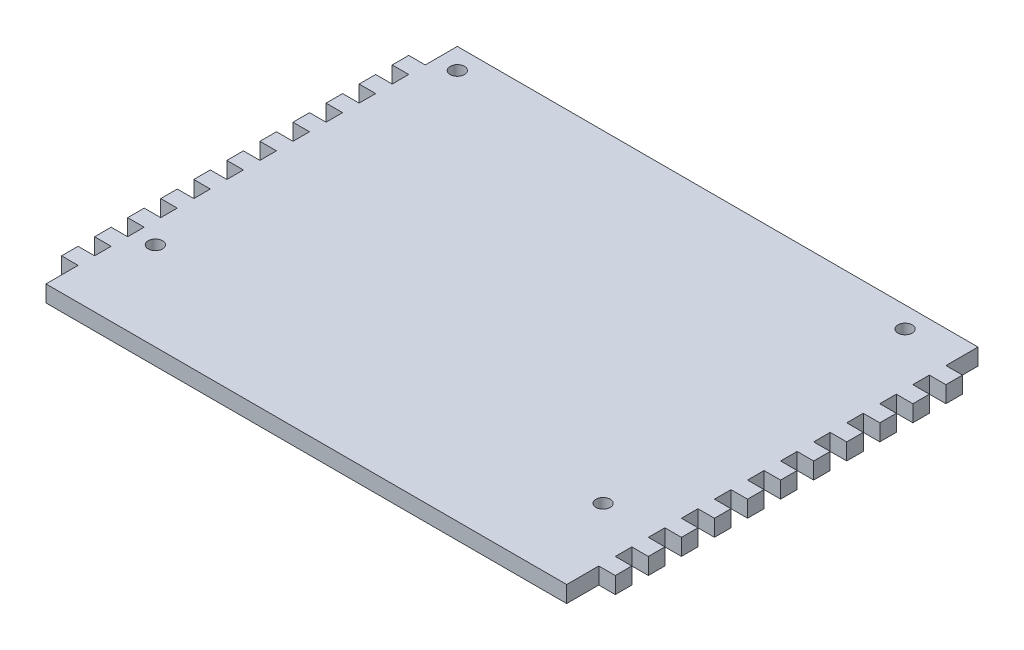
from build123d import *

# Parameters (mm, degrees)
SKETCH1_W                = 100
SKETCH1_H                = 79
BOSS_EXTRUDE1_DEPTH      = 3.175
SKETCH3_R                = 1.375
CUT_EXTRUDE1_DEPTH       = 10
SKETCH4_W                = 6.35
SKETCH4_H                = 79
BOSS_EXTRUDE2_DEPTH      = 3.175
SKETCH5_W                = 3.175
SKETCH5_H                = 3.175
CUT_EXTRUDE2_DEPTH       = 10
LPATTERN1_COUNT          = 7
LPATTERN1_PITCH          = 6.35
LPATTERN1_COUNT_DIR2     = 7
LPATTERN1_PITCH_DIR2     = 6.35
SKETCH6_W                = 3.175
SKETCH6_H                = 2.9875
CUT_EXTRUDE3_DEPTH       = 10
MIRROR1_COPY_1_SKETCH_W  = 3.175
MIRROR1_COPY_1_SKETCH_H  = 3.175
MIRROR1_COPY_1_DEPTH     = 10
MIRROR1_COPY_2_SKETCH_W  = 3.175
MIRROR1_COPY_2_SKETCH_H  = 3.175
MIRROR1_COPY_2_DEPTH     = 10
MIRROR1_COPY_3_SKETCH_W  = 3.175
MIRROR1_COPY_3_SKETCH_H  = 3.175
MIRROR1_COPY_3_DEPTH     = 10
MIRROR1_COPY_4_SKETCH_W  = 3.175
MIRROR1_COPY_4_SKETCH_H  = 3.175
MIRROR1_COPY_4_DEPTH     = 10
MIRROR1_COPY_5_SKETCH_W  = 3.175
MIRROR1_COPY_5_SKETCH_H  = 3.175
MIRROR1_COPY_5_DEPTH     = 10
MIRROR1_COPY_6_SKETCH_W  = 3.175
MIRROR1_COPY_6_SKETCH_H  = 3.175
MIRROR1_COPY_6_DEPTH     = 10
MIRROR1_COPY_7_SKETCH_W  = 3.175
MIRROR1_COPY_7_SKETCH_H  = 3.175
MIRROR1_COPY_7_DEPTH     = 10
MIRROR1_COPY_8_SKETCH_W  = 3.175
MIRROR1_COPY_8_SKETCH_H  = 3.175
MIRROR1_COPY_8_DEPTH     = 10
MIRROR1_COPY_9_SKETCH_W  = 3.175
MIRROR1_COPY_9_SKETCH_H  = 3.175
MIRROR1_COPY_9_DEPTH     = 10
MIRROR1_COPY_10_SKETCH_W = 3.175
MIRROR1_COPY_10_SKETCH_H = 3.175
MIRROR1_COPY_10_DEPTH    = 10
MIRROR1_COPY_11_SKETCH_W = 3.175
MIRROR1_COPY_11_SKETCH_H = 3.175
MIRROR1_COPY_11_DEPTH    = 10
MIRROR1_COPY_12_SKETCH_W = 3.175
MIRROR1_COPY_12_SKETCH_H = 3.175
MIRROR1_COPY_12_DEPTH    = 10
MIRROR1_COPY_13_SKETCH_W = 3.175
MIRROR1_COPY_13_SKETCH_H = 3.175
MIRROR1_COPY_13_DEPTH    = 10
MIRROR1_COPY_14_SKETCH_W = 3.175
MIRROR1_COPY_14_SKETCH_H = 3.175
MIRROR1_COPY_14_DEPTH    = 10
MIRROR1_COPY_15_SKETCH_W = 3.175
MIRROR1_COPY_15_SKETCH_H = 3.175
MIRROR1_COPY_15_DEPTH    = 10
MIRROR1_COPY_16_SKETCH_W = 3.175
MIRROR1_COPY_16_SKETCH_H = 3.175
MIRROR1_COPY_16_DEPTH    = 10
MIRROR1_COPY_17_SKETCH_W = 3.175
MIRROR1_COPY_17_SKETCH_H = 3.175
MIRROR1_COPY_17_DEPTH    = 10
MIRROR1_COPY_18_SKETCH_W = 3.175
MIRROR1_COPY_18_SKETCH_H = 3.175
MIRROR1_COPY_18_DEPTH    = 10
MIRROR1_COPY_19_SKETCH_W = 3.175
MIRROR1_COPY_19_SKETCH_H = 3.175
MIRROR1_COPY_19_DEPTH    = 10
MIRROR1_COPY_20_SKETCH_W = 3.175
MIRROR1_COPY_20_SKETCH_H = 3.175
MIRROR1_COPY_20_DEPTH    = 10
MIRROR1_COPY_21_SKETCH_W = 3.175
MIRROR1_COPY_21_SKETCH_H = 3.175
MIRROR1_COPY_21_DEPTH    = 10
MIRROR1_COPY_22_SKETCH_W = 3.175
MIRROR1_COPY_22_SKETCH_H = 3.175
MIRROR1_COPY_22_DEPTH    = 10
MIRROR1_COPY_23_SKETCH_W = 3.175
MIRROR1_COPY_23_SKETCH_H = 3.175
MIRROR1_COPY_23_DEPTH    = 10
MIRROR1_COPY_24_SKETCH_W = 3.175
MIRROR1_COPY_24_SKETCH_H = 3.175
MIRROR1_COPY_24_DEPTH    = 10
MIRROR1_COPY_25_SKETCH_W = 3.175
MIRROR1_COPY_25_SKETCH_H = 3.175
MIRROR1_COPY_25_DEPTH    = 10
MIRROR1_COPY_26_SKETCH_W = 3.175
MIRROR1_COPY_26_SKETCH_H = 3.175
MIRROR1_COPY_26_DEPTH    = 10
MIRROR1_COPY_27_SKETCH_W = 3.175
MIRROR1_COPY_27_SKETCH_H = 3.175
MIRROR1_COPY_27_DEPTH    = 10
MIRROR1_COPY_28_SKETCH_W = 3.175
MIRROR1_COPY_28_SKETCH_H = 3.175
MIRROR1_COPY_28_DEPTH    = 10
MIRROR1_COPY_29_SKETCH_W = 3.175
MIRROR1_COPY_29_SKETCH_H = 3.175
MIRROR1_COPY_29_DEPTH    = 10
MIRROR1_COPY_30_SKETCH_W = 3.175
MIRROR1_COPY_30_SKETCH_H = 3.175
MIRROR1_COPY_30_DEPTH    = 10
MIRROR1_COPY_31_SKETCH_W = 3.175
MIRROR1_COPY_31_SKETCH_H = 3.175
MIRROR1_COPY_31_DEPTH    = 10
MIRROR1_COPY_32_SKETCH_W = 3.175
MIRROR1_COPY_32_SKETCH_H = 3.175
MIRROR1_COPY_32_DEPTH    = 10
MIRROR1_COPY_33_SKETCH_W = 3.175
MIRROR1_COPY_33_SKETCH_H = 3.175
MIRROR1_COPY_33_DEPTH    = 10
MIRROR1_COPY_34_SKETCH_W = 3.175
MIRROR1_COPY_34_SKETCH_H = 3.175
MIRROR1_COPY_34_DEPTH    = 10
MIRROR1_COPY_35_SKETCH_W = 3.175
MIRROR1_COPY_35_SKETCH_H = 3.175
MIRROR1_COPY_35_DEPTH    = 10
MIRROR1_COPY_36_SKETCH_W = 3.175
MIRROR1_COPY_36_SKETCH_H = 3.175
MIRROR1_COPY_36_DEPTH    = 10
MIRROR1_COPY_37_SKETCH_W = 3.175
MIRROR1_COPY_37_SKETCH_H = 3.175
MIRROR1_COPY_37_DEPTH    = 10
MIRROR1_COPY_38_SKETCH_W = 3.175
MIRROR1_COPY_38_SKETCH_H = 3.175
MIRROR1_COPY_38_DEPTH    = 10
MIRROR1_COPY_39_SKETCH_W = 3.175
MIRROR1_COPY_39_SKETCH_H = 3.175
MIRROR1_COPY_39_DEPTH    = 10
MIRROR1_COPY_40_SKETCH_W = 3.175
MIRROR1_COPY_40_SKETCH_H = 3.175
MIRROR1_COPY_40_DEPTH    = 10
MIRROR1_COPY_41_SKETCH_W = 3.175
MIRROR1_COPY_41_SKETCH_H = 3.175
MIRROR1_COPY_41_DEPTH    = 10
MIRROR1_COPY_42_SKETCH_W = 3.175
MIRROR1_COPY_42_SKETCH_H = 3.175
MIRROR1_COPY_42_DEPTH    = 10
MIRROR1_COPY_43_SKETCH_W = 3.175
MIRROR1_COPY_43_SKETCH_H = 3.175
MIRROR1_COPY_43_DEPTH    = 10
MIRROR1_COPY_44_SKETCH_W = 3.175
MIRROR1_COPY_44_SKETCH_H = 3.175
MIRROR1_COPY_44_DEPTH    = 10
MIRROR1_COPY_45_SKETCH_W = 3.175
MIRROR1_COPY_45_SKETCH_H = 3.175
MIRROR1_COPY_45_DEPTH    = 10
MIRROR1_COPY_46_SKETCH_W = 3.175
MIRROR1_COPY_46_SKETCH_H = 3.175
MIRROR1_COPY_46_DEPTH    = 10
MIRROR1_COPY_47_SKETCH_W = 3.175
MIRROR1_COPY_47_SKETCH_H = 3.175
MIRROR1_COPY_47_DEPTH    = 10
SKETCH7_W                = 6
SKETCH7_H                = 79
SKETCH7_R                = 1.5
BOSS_EXTRUDE3_DEPTH      = 3.175
SKETCH8_W                = 3.175
SKETCH8_H                = 79
BOSS_EXTRUDE4_DEPTH      = 3.175
SKETCH10_W               = 12.35
SKETCH10_H               = 79
CUT_EXTRUDE4_DEPTH       = 10


with BuildPart() as part:
    # Sketch1 → Boss-Extrude1 (new body)
    with BuildSketch(Plane(origin=(0, 0, 0), x_dir=(1, 0, 0), z_dir=(0, 1, 0))):
        Rectangle(SKETCH1_W, SKETCH1_H)
    extrude(amount=BOSS_EXTRUDE1_DEPTH)

    # Sketch3 → Cut-Extrude1 (cut)
    with BuildSketch(Plane(origin=(0, 3.175, 0), x_dir=(1, 0, 0), z_dir=(0, 1, 0))):
        with Locations(Location((-46, 35.5, 0), (0, 0, 270))):
            Circle(SKETCH3_R)
        with Locations(Location((-46, -22.5, 0), (0, 0, 270))):
            Circle(SKETCH3_R)
        with Locations(Location((40, 35.5, 0), (0, 0, 270))):
            Circle(SKETCH3_R)
        with Locations(Location((40, -22.5, 0), (0, 0, 270))):
            Circle(SKETCH3_R)
    extrude(amount=-CUT_EXTRUDE1_DEPTH, mode=Mode.SUBTRACT)

    # Sketch4 → Boss-Extrude2 (add)
    with BuildSketch(Plane(origin=(0, 3.175, 0), x_dir=(1, 0, 0), z_dir=(0, 1, 0))):
        with Locations((-53.175, 0)):
            Rectangle(SKETCH4_W, SKETCH4_H)
        with Locations((53.175, 0)):
            Rectangle(SKETCH4_W, SKETCH4_H)
    extrude(amount=-BOSS_EXTRUDE2_DEPTH)

    # Sketch5 → Cut-Extrude2 (cut)
    with BuildSketch(Plane(origin=(0, 3.175, 0), x_dir=(1, 0, 0), z_dir=(0, 1, 0))):
        with Locations((-51.5875, 3.175)):
            Rectangle(SKETCH5_W, SKETCH5_H)
    cut_extrude2 = extrude(amount=-CUT_EXTRUDE2_DEPTH, mode=Mode.SUBTRACT)

    # LPattern1: Cut-Extrude2 7 × 7, 1 skipped
    with Locations(*[Vector(0, 0, 1) * (i * LPATTERN1_PITCH) + Vector(0, 0, -1) * (j * LPATTERN1_PITCH_DIR2) for i in range(LPATTERN1_COUNT) for j in range(LPATTERN1_COUNT_DIR2) if (i, j) not in ((0, 0), (0, 6))]):
        add(cut_extrude2, mode=Mode.SUBTRACT)

    # Sketch6 → Cut-Extrude3 (cut)
    with BuildSketch(Plane(origin=(0, 3.175, 0), x_dir=(1, 0, 0), z_dir=(0, 1, 0))):
        with Locations((-51.5875, 38.00625)):
            Rectangle(SKETCH6_W, SKETCH6_H)
        with Locations((-51.5875, -38.00625)):
            Rectangle(SKETCH6_W, SKETCH6_H)
    cut_extrude3 = extrude(amount=-CUT_EXTRUDE3_DEPTH, mode=Mode.SUBTRACT)

    # Mirror1: Cut-Extrude2, Cut-Extrude3 across plane
    add(cut_extrude2.mirror(Plane(origin=(0, 0, 0), x_dir=(0, 0, 1), z_dir=(1, 0, 0))), mode=Mode.SUBTRACT)
    add(cut_extrude3.mirror(Plane(origin=(0, 0, 0), x_dir=(0, 0, 1), z_dir=(1, 0, 0))), mode=Mode.SUBTRACT)

    # Mirror1 copy 1 sketch → Mirror1 copy 1 (cut)
    with BuildSketch(Plane(origin=(0, 3.175, -6.35), x_dir=(-1, 0, 0), z_dir=(0, 1, 0))):
        with Locations((-51.5875, -3.175)):
            Rectangle(MIRROR1_COPY_1_SKETCH_W, MIRROR1_COPY_1_SKETCH_H)
    extrude(amount=-MIRROR1_COPY_1_DEPTH, mode=Mode.SUBTRACT)

    # Mirror1 copy 2 sketch → Mirror1 copy 2 (cut)
    with BuildSketch(Plane(origin=(0, 3.175, -12.7), x_dir=(-1, 0, 0), z_dir=(0, 1, 0))):
        with Locations((-51.5875, -3.175)):
            Rectangle(MIRROR1_COPY_2_SKETCH_W, MIRROR1_COPY_2_SKETCH_H)
    extrude(amount=-MIRROR1_COPY_2_DEPTH, mode=Mode.SUBTRACT)

    # Mirror1 copy 3 sketch → Mirror1 copy 3 (cut)
    with BuildSketch(Plane(origin=(0, 3.175, -19.05), x_dir=(-1, 0, 0), z_dir=(0, 1, 0))):
        with Locations((-51.5875, -3.175)):
            Rectangle(MIRROR1_COPY_3_SKETCH_W, MIRROR1_COPY_3_SKETCH_H)
    extrude(amount=-MIRROR1_COPY_3_DEPTH, mode=Mode.SUBTRACT)

    # Mirror1 copy 4 sketch → Mirror1 copy 4 (cut)
    with BuildSketch(Plane(origin=(0, 3.175, -25.4), x_dir=(-1, 0, 0), z_dir=(0, 1, 0))):
        with Locations((-51.5875, -3.175)):
            Rectangle(MIRROR1_COPY_4_SKETCH_W, MIRROR1_COPY_4_SKETCH_H)
    extrude(amount=-MIRROR1_COPY_4_DEPTH, mode=Mode.SUBTRACT)

    # Mirror1 copy 5 sketch → Mirror1 copy 5 (cut)
    with BuildSketch(Plane(origin=(0, 3.175, -31.75), x_dir=(-1, 0, 0), z_dir=(0, 1, 0))):
        with Locations((-51.5875, -3.175)):
            Rectangle(MIRROR1_COPY_5_SKETCH_W, MIRROR1_COPY_5_SKETCH_H)
    extrude(amount=-MIRROR1_COPY_5_DEPTH, mode=Mode.SUBTRACT)

    # Mirror1 copy 6 sketch → Mirror1 copy 6 (cut)
    with BuildSketch(Plane(origin=(0, 3.175, 6.35), x_dir=(-1, 0, 0), z_dir=(0, 1, 0))):
        with Locations((-51.5875, -3.175)):
            Rectangle(MIRROR1_COPY_6_SKETCH_W, MIRROR1_COPY_6_SKETCH_H)
    extrude(amount=-MIRROR1_COPY_6_DEPTH, mode=Mode.SUBTRACT)

    # Mirror1 copy 7 sketch → Mirror1 copy 7 (cut)
    with BuildSketch(Plane(origin=(0, 3.175, 0), x_dir=(-1, 0, 0), z_dir=(0, 1, 0))):
        with Locations((-51.5875, -3.175)):
            Rectangle(MIRROR1_COPY_7_SKETCH_W, MIRROR1_COPY_7_SKETCH_H)
    extrude(amount=-MIRROR1_COPY_7_DEPTH, mode=Mode.SUBTRACT)

    # Mirror1 copy 8 sketch → Mirror1 copy 8 (cut)
    with BuildSketch(Plane(origin=(0, 3.175, -6.35), x_dir=(-1, 0, 0), z_dir=(0, 1, 0))):
        with Locations((-51.5875, -3.175)):
            Rectangle(MIRROR1_COPY_8_SKETCH_W, MIRROR1_COPY_8_SKETCH_H)
    extrude(amount=-MIRROR1_COPY_8_DEPTH, mode=Mode.SUBTRACT)

    # Mirror1 copy 9 sketch → Mirror1 copy 9 (cut)
    with BuildSketch(Plane(origin=(0, 3.175, -12.7), x_dir=(-1, 0, 0), z_dir=(0, 1, 0))):
        with Locations((-51.5875, -3.175)):
            Rectangle(MIRROR1_COPY_9_SKETCH_W, MIRROR1_COPY_9_SKETCH_H)
    extrude(amount=-MIRROR1_COPY_9_DEPTH, mode=Mode.SUBTRACT)

    # Mirror1 copy 10 sketch → Mirror1 copy 10 (cut)
    with BuildSketch(Plane(origin=(0, 3.175, -19.05), x_dir=(-1, 0, 0), z_dir=(0, 1, 0))):
        with Locations((-51.5875, -3.175)):
            Rectangle(MIRROR1_COPY_10_SKETCH_W, MIRROR1_COPY_10_SKETCH_H)
    extrude(amount=-MIRROR1_COPY_10_DEPTH, mode=Mode.SUBTRACT)

    # Mirror1 copy 11 sketch → Mirror1 copy 11 (cut)
    with BuildSketch(Plane(origin=(0, 3.175, -25.4), x_dir=(-1, 0, 0), z_dir=(0, 1, 0))):
        with Locations((-51.5875, -3.175)):
            Rectangle(MIRROR1_COPY_11_SKETCH_W, MIRROR1_COPY_11_SKETCH_H)
    extrude(amount=-MIRROR1_COPY_11_DEPTH, mode=Mode.SUBTRACT)

    # Mirror1 copy 12 sketch → Mirror1 copy 12 (cut)
    with BuildSketch(Plane(origin=(0, 3.175, -31.75), x_dir=(-1, 0, 0), z_dir=(0, 1, 0))):
        with Locations((-51.5875, -3.175)):
            Rectangle(MIRROR1_COPY_12_SKETCH_W, MIRROR1_COPY_12_SKETCH_H)
    extrude(amount=-MIRROR1_COPY_12_DEPTH, mode=Mode.SUBTRACT)

    # Mirror1 copy 13 sketch → Mirror1 copy 13 (cut)
    with BuildSketch(Plane(origin=(0, 3.175, 12.7), x_dir=(-1, 0, 0), z_dir=(0, 1, 0))):
        with Locations((-51.5875, -3.175)):
            Rectangle(MIRROR1_COPY_13_SKETCH_W, MIRROR1_COPY_13_SKETCH_H)
    extrude(amount=-MIRROR1_COPY_13_DEPTH, mode=Mode.SUBTRACT)

    # Mirror1 copy 14 sketch → Mirror1 copy 14 (cut)
    with BuildSketch(Plane(origin=(0, 3.175, 6.35), x_dir=(-1, 0, 0), z_dir=(0, 1, 0))):
        with Locations((-51.5875, -3.175)):
            Rectangle(MIRROR1_COPY_14_SKETCH_W, MIRROR1_COPY_14_SKETCH_H)
    extrude(amount=-MIRROR1_COPY_14_DEPTH, mode=Mode.SUBTRACT)

    # Mirror1 copy 15 sketch → Mirror1 copy 15 (cut)
    with BuildSketch(Plane(origin=(0, 3.175, 0), x_dir=(-1, 0, 0), z_dir=(0, 1, 0))):
        with Locations((-51.5875, -3.175)):
            Rectangle(MIRROR1_COPY_15_SKETCH_W, MIRROR1_COPY_15_SKETCH_H)
    extrude(amount=-MIRROR1_COPY_15_DEPTH, mode=Mode.SUBTRACT)

    # Mirror1 copy 16 sketch → Mirror1 copy 16 (cut)
    with BuildSketch(Plane(origin=(0, 3.175, -6.35), x_dir=(-1, 0, 0), z_dir=(0, 1, 0))):
        with Locations((-51.5875, -3.175)):
            Rectangle(MIRROR1_COPY_16_SKETCH_W, MIRROR1_COPY_16_SKETCH_H)
    extrude(amount=-MIRROR1_COPY_16_DEPTH, mode=Mode.SUBTRACT)

    # Mirror1 copy 17 sketch → Mirror1 copy 17 (cut)
    with BuildSketch(Plane(origin=(0, 3.175, -12.7), x_dir=(-1, 0, 0), z_dir=(0, 1, 0))):
        with Locations((-51.5875, -3.175)):
            Rectangle(MIRROR1_COPY_17_SKETCH_W, MIRROR1_COPY_17_SKETCH_H)
    extrude(amount=-MIRROR1_COPY_17_DEPTH, mode=Mode.SUBTRACT)

    # Mirror1 copy 18 sketch → Mirror1 copy 18 (cut)
    with BuildSketch(Plane(origin=(0, 3.175, -19.05), x_dir=(-1, 0, 0), z_dir=(0, 1, 0))):
        with Locations((-51.5875, -3.175)):
            Rectangle(MIRROR1_COPY_18_SKETCH_W, MIRROR1_COPY_18_SKETCH_H)
    extrude(amount=-MIRROR1_COPY_18_DEPTH, mode=Mode.SUBTRACT)

    # Mirror1 copy 19 sketch → Mirror1 copy 19 (cut)
    with BuildSketch(Plane(origin=(0, 3.175, -25.4), x_dir=(-1, 0, 0), z_dir=(0, 1, 0))):
        with Locations((-51.5875, -3.175)):
            Rectangle(MIRROR1_COPY_19_SKETCH_W, MIRROR1_COPY_19_SKETCH_H)
    extrude(amount=-MIRROR1_COPY_19_DEPTH, mode=Mode.SUBTRACT)

    # Mirror1 copy 20 sketch → Mirror1 copy 20 (cut)
    with BuildSketch(Plane(origin=(0, 3.175, 19.05), x_dir=(-1, 0, 0), z_dir=(0, 1, 0))):
        with Locations((-51.5875, -3.175)):
            Rectangle(MIRROR1_COPY_20_SKETCH_W, MIRROR1_COPY_20_SKETCH_H)
    extrude(amount=-MIRROR1_COPY_20_DEPTH, mode=Mode.SUBTRACT)

    # Mirror1 copy 21 sketch → Mirror1 copy 21 (cut)
    with BuildSketch(Plane(origin=(0, 3.175, 12.7), x_dir=(-1, 0, 0), z_dir=(0, 1, 0))):
        with Locations((-51.5875, -3.175)):
            Rectangle(MIRROR1_COPY_21_SKETCH_W, MIRROR1_COPY_21_SKETCH_H)
    extrude(amount=-MIRROR1_COPY_21_DEPTH, mode=Mode.SUBTRACT)

    # Mirror1 copy 22 sketch → Mirror1 copy 22 (cut)
    with BuildSketch(Plane(origin=(0, 3.175, 6.35), x_dir=(-1, 0, 0), z_dir=(0, 1, 0))):
        with Locations((-51.5875, -3.175)):
            Rectangle(MIRROR1_COPY_22_SKETCH_W, MIRROR1_COPY_22_SKETCH_H)
    extrude(amount=-MIRROR1_COPY_22_DEPTH, mode=Mode.SUBTRACT)

    # Mirror1 copy 23 sketch → Mirror1 copy 23 (cut)
    with BuildSketch(Plane(origin=(0, 3.175, 0), x_dir=(-1, 0, 0), z_dir=(0, 1, 0))):
        with Locations((-51.5875, -3.175)):
            Rectangle(MIRROR1_COPY_23_SKETCH_W, MIRROR1_COPY_23_SKETCH_H)
    extrude(amount=-MIRROR1_COPY_23_DEPTH, mode=Mode.SUBTRACT)

    # Mirror1 copy 24 sketch → Mirror1 copy 24 (cut)
    with BuildSketch(Plane(origin=(0, 3.175, -6.35), x_dir=(-1, 0, 0), z_dir=(0, 1, 0))):
        with Locations((-51.5875, -3.175)):
            Rectangle(MIRROR1_COPY_24_SKETCH_W, MIRROR1_COPY_24_SKETCH_H)
    extrude(amount=-MIRROR1_COPY_24_DEPTH, mode=Mode.SUBTRACT)

    # Mirror1 copy 25 sketch → Mirror1 copy 25 (cut)
    with BuildSketch(Plane(origin=(0, 3.175, -12.7), x_dir=(-1, 0, 0), z_dir=(0, 1, 0))):
        with Locations((-51.5875, -3.175)):
            Rectangle(MIRROR1_COPY_25_SKETCH_W, MIRROR1_COPY_25_SKETCH_H)
    extrude(amount=-MIRROR1_COPY_25_DEPTH, mode=Mode.SUBTRACT)

    # Mirror1 copy 26 sketch → Mirror1 copy 26 (cut)
    with BuildSketch(Plane(origin=(0, 3.175, -19.05), x_dir=(-1, 0, 0), z_dir=(0, 1, 0))):
        with Locations((-51.5875, -3.175)):
            Rectangle(MIRROR1_COPY_26_SKETCH_W, MIRROR1_COPY_26_SKETCH_H)
    extrude(amount=-MIRROR1_COPY_26_DEPTH, mode=Mode.SUBTRACT)

    # Mirror1 copy 27 sketch → Mirror1 copy 27 (cut)
    with BuildSketch(Plane(origin=(0, 3.175, 25.4), x_dir=(-1, 0, 0), z_dir=(0, 1, 0))):
        with Locations((-51.5875, -3.175)):
            Rectangle(MIRROR1_COPY_27_SKETCH_W, MIRROR1_COPY_27_SKETCH_H)
    extrude(amount=-MIRROR1_COPY_27_DEPTH, mode=Mode.SUBTRACT)

    # Mirror1 copy 28 sketch → Mirror1 copy 28 (cut)
    with BuildSketch(Plane(origin=(0, 3.175, 19.05), x_dir=(-1, 0, 0), z_dir=(0, 1, 0))):
        with Locations((-51.5875, -3.175)):
            Rectangle(MIRROR1_COPY_28_SKETCH_W, MIRROR1_COPY_28_SKETCH_H)
    extrude(amount=-MIRROR1_COPY_28_DEPTH, mode=Mode.SUBTRACT)

    # Mirror1 copy 29 sketch → Mirror1 copy 29 (cut)
    with BuildSketch(Plane(origin=(0, 3.175, 12.7), x_dir=(-1, 0, 0), z_dir=(0, 1, 0))):
        with Locations((-51.5875, -3.175)):
            Rectangle(MIRROR1_COPY_29_SKETCH_W, MIRROR1_COPY_29_SKETCH_H)
    extrude(amount=-MIRROR1_COPY_29_DEPTH, mode=Mode.SUBTRACT)

    # Mirror1 copy 30 sketch → Mirror1 copy 30 (cut)
    with BuildSketch(Plane(origin=(0, 3.175, 6.35), x_dir=(-1, 0, 0), z_dir=(0, 1, 0))):
        with Locations((-51.5875, -3.175)):
            Rectangle(MIRROR1_COPY_30_SKETCH_W, MIRROR1_COPY_30_SKETCH_H)
    extrude(amount=-MIRROR1_COPY_30_DEPTH, mode=Mode.SUBTRACT)

    # Mirror1 copy 31 sketch → Mirror1 copy 31 (cut)
    with BuildSketch(Plane(origin=(0, 3.175, 0), x_dir=(-1, 0, 0), z_dir=(0, 1, 0))):
        with Locations((-51.5875, -3.175)):
            Rectangle(MIRROR1_COPY_31_SKETCH_W, MIRROR1_COPY_31_SKETCH_H)
    extrude(amount=-MIRROR1_COPY_31_DEPTH, mode=Mode.SUBTRACT)

    # Mirror1 copy 32 sketch → Mirror1 copy 32 (cut)
    with BuildSketch(Plane(origin=(0, 3.175, -6.35), x_dir=(-1, 0, 0), z_dir=(0, 1, 0))):
        with Locations((-51.5875, -3.175)):
            Rectangle(MIRROR1_COPY_32_SKETCH_W, MIRROR1_COPY_32_SKETCH_H)
    extrude(amount=-MIRROR1_COPY_32_DEPTH, mode=Mode.SUBTRACT)

    # Mirror1 copy 33 sketch → Mirror1 copy 33 (cut)
    with BuildSketch(Plane(origin=(0, 3.175, -12.7), x_dir=(-1, 0, 0), z_dir=(0, 1, 0))):
        with Locations((-51.5875, -3.175)):
            Rectangle(MIRROR1_COPY_33_SKETCH_W, MIRROR1_COPY_33_SKETCH_H)
    extrude(amount=-MIRROR1_COPY_33_DEPTH, mode=Mode.SUBTRACT)

    # Mirror1 copy 34 sketch → Mirror1 copy 34 (cut)
    with BuildSketch(Plane(origin=(0, 3.175, 31.75), x_dir=(-1, 0, 0), z_dir=(0, 1, 0))):
        with Locations((-51.5875, -3.175)):
            Rectangle(MIRROR1_COPY_34_SKETCH_W, MIRROR1_COPY_34_SKETCH_H)
    extrude(amount=-MIRROR1_COPY_34_DEPTH, mode=Mode.SUBTRACT)

    # Mirror1 copy 35 sketch → Mirror1 copy 35 (cut)
    with BuildSketch(Plane(origin=(0, 3.175, 25.4), x_dir=(-1, 0, 0), z_dir=(0, 1, 0))):
        with Locations((-51.5875, -3.175)):
            Rectangle(MIRROR1_COPY_35_SKETCH_W, MIRROR1_COPY_35_SKETCH_H)
    extrude(amount=-MIRROR1_COPY_35_DEPTH, mode=Mode.SUBTRACT)

    # Mirror1 copy 36 sketch → Mirror1 copy 36 (cut)
    with BuildSketch(Plane(origin=(0, 3.175, 19.05), x_dir=(-1, 0, 0), z_dir=(0, 1, 0))):
        with Locations((-51.5875, -3.175)):
            Rectangle(MIRROR1_COPY_36_SKETCH_W, MIRROR1_COPY_36_SKETCH_H)
    extrude(amount=-MIRROR1_COPY_36_DEPTH, mode=Mode.SUBTRACT)

    # Mirror1 copy 37 sketch → Mirror1 copy 37 (cut)
    with BuildSketch(Plane(origin=(0, 3.175, 12.7), x_dir=(-1, 0, 0), z_dir=(0, 1, 0))):
        with Locations((-51.5875, -3.175)):
            Rectangle(MIRROR1_COPY_37_SKETCH_W, MIRROR1_COPY_37_SKETCH_H)
    extrude(amount=-MIRROR1_COPY_37_DEPTH, mode=Mode.SUBTRACT)

    # Mirror1 copy 38 sketch → Mirror1 copy 38 (cut)
    with BuildSketch(Plane(origin=(0, 3.175, 6.35), x_dir=(-1, 0, 0), z_dir=(0, 1, 0))):
        with Locations((-51.5875, -3.175)):
            Rectangle(MIRROR1_COPY_38_SKETCH_W, MIRROR1_COPY_38_SKETCH_H)
    extrude(amount=-MIRROR1_COPY_38_DEPTH, mode=Mode.SUBTRACT)

    # Mirror1 copy 39 sketch → Mirror1 copy 39 (cut)
    with BuildSketch(Plane(origin=(0, 3.175, 0), x_dir=(-1, 0, 0), z_dir=(0, 1, 0))):
        with Locations((-51.5875, -3.175)):
            Rectangle(MIRROR1_COPY_39_SKETCH_W, MIRROR1_COPY_39_SKETCH_H)
    extrude(amount=-MIRROR1_COPY_39_DEPTH, mode=Mode.SUBTRACT)

    # Mirror1 copy 40 sketch → Mirror1 copy 40 (cut)
    with BuildSketch(Plane(origin=(0, 3.175, -6.35), x_dir=(-1, 0, 0), z_dir=(0, 1, 0))):
        with Locations((-51.5875, -3.175)):
            Rectangle(MIRROR1_COPY_40_SKETCH_W, MIRROR1_COPY_40_SKETCH_H)
    extrude(amount=-MIRROR1_COPY_40_DEPTH, mode=Mode.SUBTRACT)

    # Mirror1 copy 41 sketch → Mirror1 copy 41 (cut)
    with BuildSketch(Plane(origin=(0, 3.175, 38.1), x_dir=(-1, 0, 0), z_dir=(0, 1, 0))):
        with Locations((-51.5875, -3.175)):
            Rectangle(MIRROR1_COPY_41_SKETCH_W, MIRROR1_COPY_41_SKETCH_H)
    extrude(amount=-MIRROR1_COPY_41_DEPTH, mode=Mode.SUBTRACT)

    # Mirror1 copy 42 sketch → Mirror1 copy 42 (cut)
    with BuildSketch(Plane(origin=(0, 3.175, 31.75), x_dir=(-1, 0, 0), z_dir=(0, 1, 0))):
        with Locations((-51.5875, -3.175)):
            Rectangle(MIRROR1_COPY_42_SKETCH_W, MIRROR1_COPY_42_SKETCH_H)
    extrude(amount=-MIRROR1_COPY_42_DEPTH, mode=Mode.SUBTRACT)

    # Mirror1 copy 43 sketch → Mirror1 copy 43 (cut)
    with BuildSketch(Plane(origin=(0, 3.175, 25.4), x_dir=(-1, 0, 0), z_dir=(0, 1, 0))):
        with Locations((-51.5875, -3.175)):
            Rectangle(MIRROR1_COPY_43_SKETCH_W, MIRROR1_COPY_43_SKETCH_H)
    extrude(amount=-MIRROR1_COPY_43_DEPTH, mode=Mode.SUBTRACT)

    # Mirror1 copy 44 sketch → Mirror1 copy 44 (cut)
    with BuildSketch(Plane(origin=(0, 3.175, 19.05), x_dir=(-1, 0, 0), z_dir=(0, 1, 0))):
        with Locations((-51.5875, -3.175)):
            Rectangle(MIRROR1_COPY_44_SKETCH_W, MIRROR1_COPY_44_SKETCH_H)
    extrude(amount=-MIRROR1_COPY_44_DEPTH, mode=Mode.SUBTRACT)

    # Mirror1 copy 45 sketch → Mirror1 copy 45 (cut)
    with BuildSketch(Plane(origin=(0, 3.175, 12.7), x_dir=(-1, 0, 0), z_dir=(0, 1, 0))):
        with Locations((-51.5875, -3.175)):
            Rectangle(MIRROR1_COPY_45_SKETCH_W, MIRROR1_COPY_45_SKETCH_H)
    extrude(amount=-MIRROR1_COPY_45_DEPTH, mode=Mode.SUBTRACT)

    # Mirror1 copy 46 sketch → Mirror1 copy 46 (cut)
    with BuildSketch(Plane(origin=(0, 3.175, 6.35), x_dir=(-1, 0, 0), z_dir=(0, 1, 0))):
        with Locations((-51.5875, -3.175)):
            Rectangle(MIRROR1_COPY_46_SKETCH_W, MIRROR1_COPY_46_SKETCH_H)
    extrude(amount=-MIRROR1_COPY_46_DEPTH, mode=Mode.SUBTRACT)

    # Mirror1 copy 47 sketch → Mirror1 copy 47 (cut)
    with BuildSketch(Plane(origin=(0, 3.175, 0), x_dir=(-1, 0, 0), z_dir=(0, 1, 0))):
        with Locations((-51.5875, -3.175)):
            Rectangle(MIRROR1_COPY_47_SKETCH_W, MIRROR1_COPY_47_SKETCH_H)
    extrude(amount=-MIRROR1_COPY_47_DEPTH, mode=Mode.SUBTRACT)

    # Sketch7 → Boss-Extrude3 (add)
    # profile 1 of 2: a face of its own
    with BuildSketch(Plane(origin=(0, 3.175, 0), x_dir=(1, 0, 0), z_dir=(0, 1, 0))):
        with Locations((59.35, 0)):
            Rectangle(SKETCH7_W, SKETCH7_H)
        with Locations(Location((59.35, 31.5, 0), (0, 0, 270))):
            Circle(SKETCH7_R, mode=Mode.SUBTRACT)
        with Locations(Location((59.35, -31.5, 0), (0, 0, 270))):
            Circle(SKETCH7_R, mode=Mode.SUBTRACT)
    # profile 2 of 2: a face of its own
    with BuildSketch(Plane(origin=(0, 3.175, 0), x_dir=(1, 0, 0), z_dir=(0, 1, 0))):
        with Locations((-59.35, 0)):
            Rectangle(SKETCH7_W, SKETCH7_H)
        with Locations(Location((-59.35, 31.5, 0), (0, 0, 270))):
            Circle(SKETCH7_R, mode=Mode.SUBTRACT)
        with Locations(Location((-59.35, -31.5, 0), (0, 0, 270))):
            Circle(SKETCH7_R, mode=Mode.SUBTRACT)
    extrude(amount=-BOSS_EXTRUDE3_DEPTH)

    # Sketch8 → Boss-Extrude4 (add)
    with BuildSketch(Plane(origin=(0, 3.175, 0), x_dir=(1, 0, 0), z_dir=(0, 1, 0))):
        with Locations((-63.9375, 0)):
            Rectangle(SKETCH8_W, SKETCH8_H)
        with Locations((63.9375, 0)):
            Rectangle(SKETCH8_W, SKETCH8_H)
    extrude(amount=-BOSS_EXTRUDE4_DEPTH)

    # Sketch10 → Cut-Extrude4 (cut)
    with BuildSketch(Plane(origin=(0, 3.175, 0), x_dir=(1, 0, 0), z_dir=(0, 1, 0))):
        with Locations((-59.35, 0)):
            Rectangle(SKETCH10_W, SKETCH10_H)
        with Locations((59.35, 0)):
            Rectangle(SKETCH10_W, SKETCH10_H)
    extrude(amount=-CUT_EXTRUDE4_DEPTH, mode=Mode.SUBTRACT)


solid = part.part
